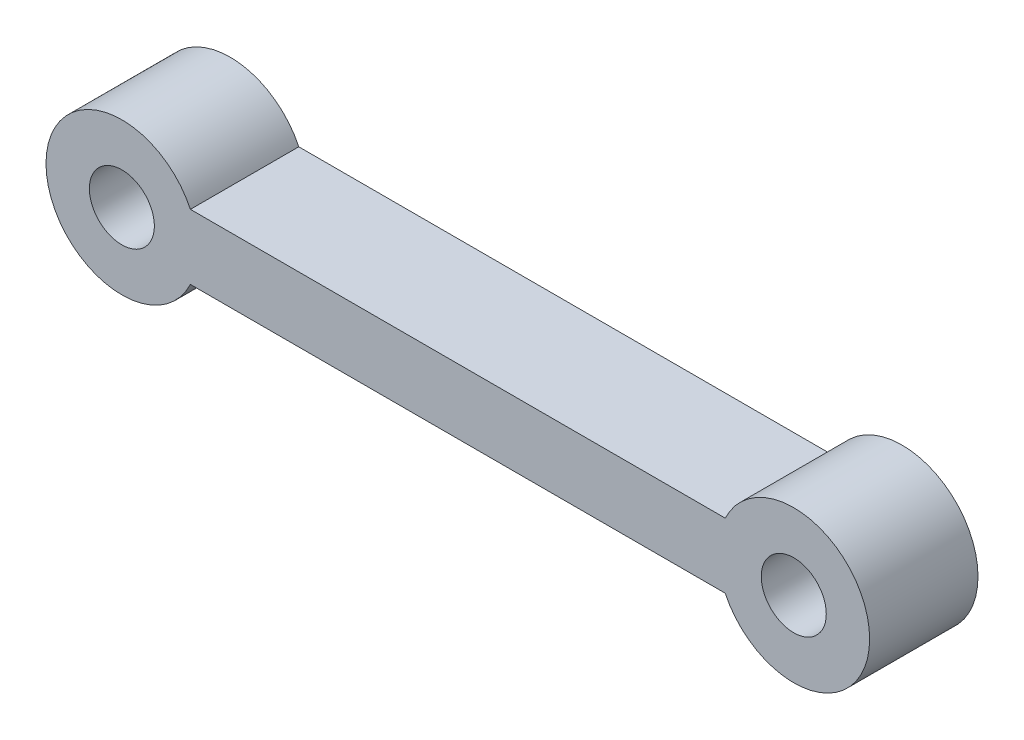
from build123d import *

# Parameters (mm, degrees)
SKETCH_1_R      = 1.5
EXTRUDE_1_DEPTH = 5


with BuildPart() as part:
    # 스케치1 → 보스-돌출1 (new body)
    # profile 1 of 5: a face of its own
    with BuildSketch(Plane.XY):
        with BuildLine():
            Line((27.83772234, 1.5), (3.16227766, 1.5))
            ThreePointArc((3.16227766, 1.5), (3.414525722, 0.768774411), (3.5, 0))
            ThreePointArc((3.5, 0), (3.414525722, -0.768774411), (3.16227766, -1.5))
            Line((3.16227766, -1.5), (27.83772234, -1.5))
            ThreePointArc((27.83772234, -1.5), (27.5, 0), (27.83772234, 1.5))
        make_face()
    # profile 2 of 5: a face of its own
    with BuildSketch(Plane.XY):
        with BuildLine():
            ThreePointArc((3.16227766, 1.5), (1.870828693, 2.958039892), (0, 3.5))
            ThreePointArc((0, 3.5), (-3.5, 0), (0, -3.5))
            ThreePointArc((0, -3.5), (1.870828693, -2.958039892), (3.16227766, -1.5))
            Line((3.16227766, -1.5), (3.16227766, 1.5))
        make_face()
        Circle(SKETCH_1_R, mode=Mode.SUBTRACT)
    # profile 3 of 5: a face of its own
    with BuildSketch(Plane.XY):
        with BuildLine():
            ThreePointArc((34.5, 0), (33.474873734, 2.474873734), (31, 3.5))
            ThreePointArc((31, 3.5), (29.129171307, 2.958039892), (27.83772234, 1.5))
            Line((27.83772234, 1.5), (27.83772234, -1.5))
            ThreePointArc((27.83772234, -1.5), (29.129171307, -2.958039892), (31, -3.5))
            ThreePointArc((31, -3.5), (33.474873734, -2.474873734), (34.5, 0))
        make_face()
        with Locations((31, 0)):
            Circle(SKETCH_1_R, mode=Mode.SUBTRACT)
    # profile 4 of 5: a face of its own
    with BuildSketch(Plane.XY):
        with BuildLine():
            ThreePointArc((3.5, 0), (3.414525722, 0.768774411), (3.16227766, 1.5))
            Line((3.16227766, 1.5), (3.16227766, -1.5))
            ThreePointArc((3.16227766, -1.5), (3.414525722, -0.768774411), (3.5, 0))
        make_face()
    # profile 5 of 5: a face of its own
    with BuildSketch(Plane.XY):
        with BuildLine():
            Line((27.83772234, -1.5), (27.83772234, 1.5))
            ThreePointArc((27.83772234, 1.5), (27.5, 0), (27.83772234, -1.5))
        make_face()
    extrude(amount=EXTRUDE_1_DEPTH)


solid = part.part
